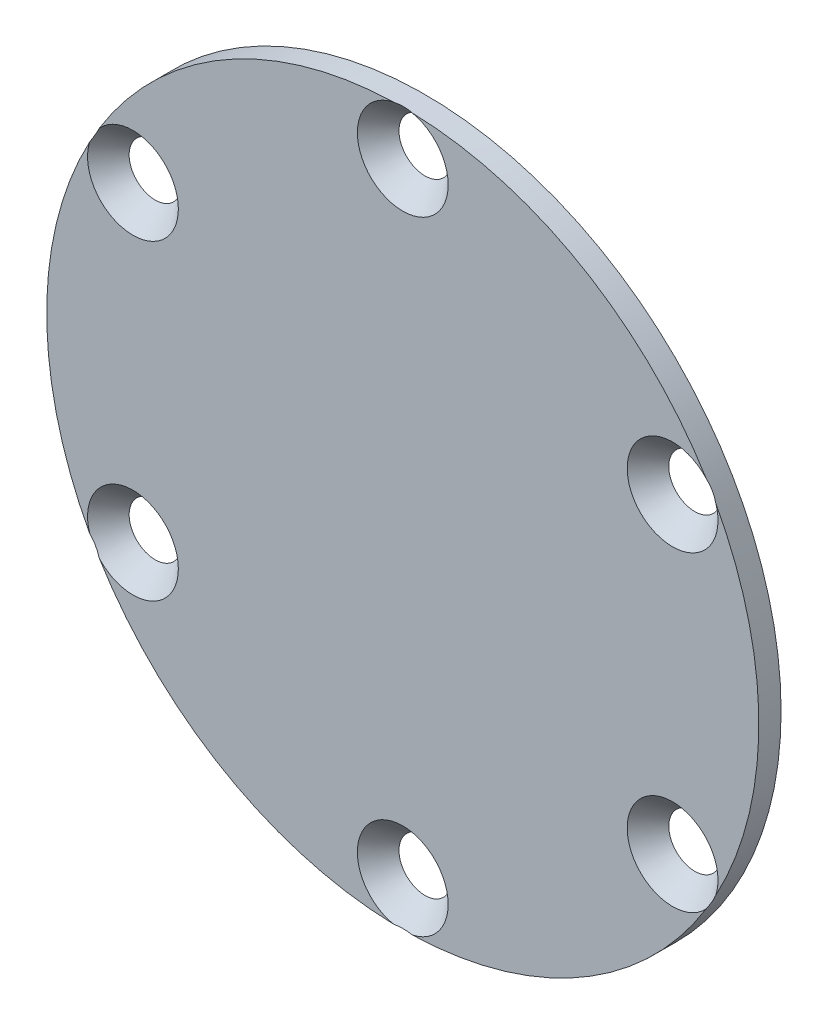
from build123d import *

# Parameters (mm, degrees)
SKETCH1_R                                     = 25.4
BOSS_EXTRUDE1_DEPTH                           = 1.5875
CSK_FOR_4_FLAT_HEAD_SOCKET_CAP_SCREW1_A_COUNT = 2
CSK_FOR_4_FLAT_HEAD_SOCKET_CAP_SCREW1_A_PITCH = 22.225
CSK_FOR_4_FLAT_HEAD_SOCKET_CAP_SCRE_2_COUNT   = 2
CSK_FOR_4_FLAT_HEAD_SOCKET_CAP_SCRE_2_PITCH   = 38.494829198
CSK_FOR_4_FLAT_HEAD_SOCKET_CAP_SCRE_3_COUNT   = 2
CSK_FOR_4_FLAT_HEAD_SOCKET_CAP_SCRE_3_PITCH   = 44.45
CSK_FOR_4_FLAT_HEAD_SOCKET_CAP_SCRE_4_COUNT   = 2
CSK_FOR_4_FLAT_HEAD_SOCKET_CAP_SCRE_4_PITCH   = 38.494829198
CSK_FOR_4_FLAT_HEAD_SOCKET_CAP_SCRE_5_COUNT   = 2
CSK_FOR_4_FLAT_HEAD_SOCKET_CAP_SCRE_5_PITCH   = 22.225


with BuildPart() as part:
    # Sketch1 → Boss-Extrude1 (new body)
    with BuildSketch(Plane.XY):
        Circle(SKETCH1_R)
    extrude(amount=BOSS_EXTRUDE1_DEPTH)

    # Sketch3 → CSK for #4 Flat Head Socket Cap Screw1 (revolve, cut)
    with BuildSketch(Plane(origin=(0, 22.225, 1.5875), x_dir=(0, -1, 0), z_dir=(1, 0, 0))):
        Polygon((0, 0), (0, 1.5875), (1.63195, 1.5875), (1.63195, 1.848124365), (3.2385, 0), align=None)
    csk_for_4_flat_head_socket_cap_screw1 = revolve(axis=Axis((0, 22.225, 7.9375), (0, 0, -1)), mode=Mode.SUBTRACT)

    # CSK for #4 Flat Head Socket Cap Screw1 a: CSK for #4 Flat Head Socket Cap Screw1 ×2
    with Locations(*[Vector(0.866025403784438, -0.500000000000001, 0) * (i * CSK_FOR_4_FLAT_HEAD_SOCKET_CAP_SCREW1_A_PITCH) for i in range(1, CSK_FOR_4_FLAT_HEAD_SOCKET_CAP_SCREW1_A_COUNT)]):
        add(csk_for_4_flat_head_socket_cap_screw1, mode=Mode.SUBTRACT)

    # CSK for _4 Flat Head Socket Cap Scre 2: CSK for #4 Flat Head Socket Cap Screw1 ×2
    with Locations(*[Vector(0.5000000000000123, -0.8660254037844316, 0) * (i * CSK_FOR_4_FLAT_HEAD_SOCKET_CAP_SCRE_2_PITCH) for i in range(1, CSK_FOR_4_FLAT_HEAD_SOCKET_CAP_SCRE_2_COUNT)]):
        add(csk_for_4_flat_head_socket_cap_screw1, mode=Mode.SUBTRACT)

    # CSK for _4 Flat Head Socket Cap Scre 3: CSK for #4 Flat Head Socket Cap Screw1 ×2
    with Locations(*[(0, -i * CSK_FOR_4_FLAT_HEAD_SOCKET_CAP_SCRE_3_PITCH, 0) for i in range(1, CSK_FOR_4_FLAT_HEAD_SOCKET_CAP_SCRE_3_COUNT)]):
        add(csk_for_4_flat_head_socket_cap_screw1, mode=Mode.SUBTRACT)

    # CSK for _4 Flat Head Socket Cap Scre 4: CSK for #4 Flat Head Socket Cap Screw1 ×2
    with Locations(*[Vector(-0.4999999999999876, -0.8660254037844458, 0) * (i * CSK_FOR_4_FLAT_HEAD_SOCKET_CAP_SCRE_4_PITCH) for i in range(1, CSK_FOR_4_FLAT_HEAD_SOCKET_CAP_SCRE_4_COUNT)]):
        add(csk_for_4_flat_head_socket_cap_screw1, mode=Mode.SUBTRACT)

    # CSK for _4 Flat Head Socket Cap Scre 5: CSK for #4 Flat Head Socket Cap Screw1 ×2
    with Locations(*[Vector(-0.8660254037844416, -0.49999999999999495, 0) * (i * CSK_FOR_4_FLAT_HEAD_SOCKET_CAP_SCRE_5_PITCH) for i in range(1, CSK_FOR_4_FLAT_HEAD_SOCKET_CAP_SCRE_5_COUNT)]):
        add(csk_for_4_flat_head_socket_cap_screw1, mode=Mode.SUBTRACT)


solid = part.part
